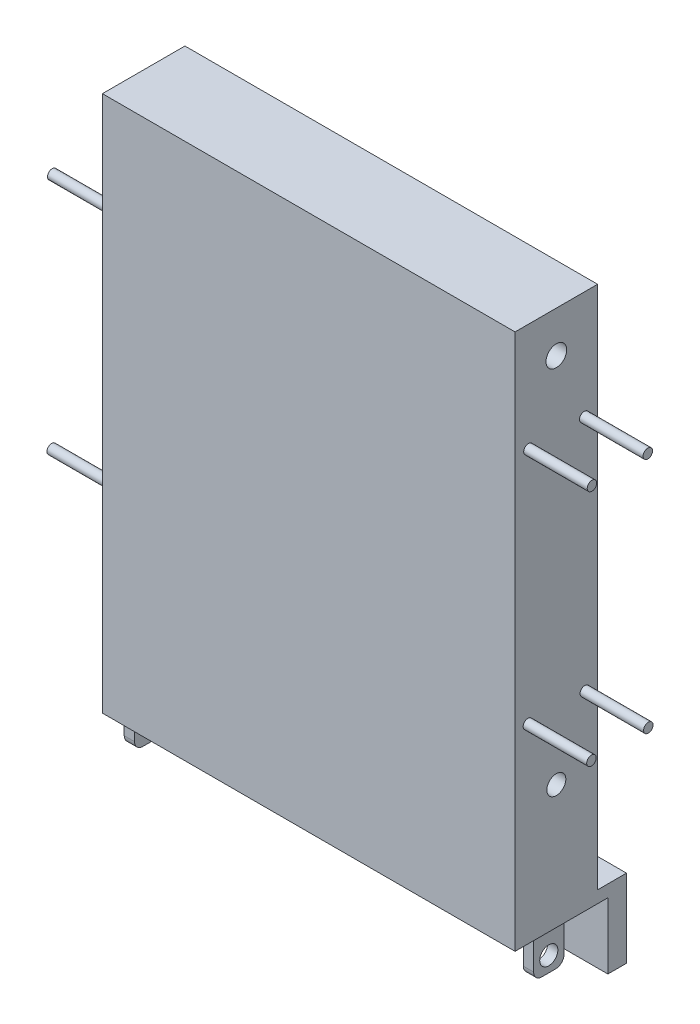
from build123d import *

# Parameters (mm, degrees)
SKETCH1_W               = 127
SKETCH1_H               = 165.1
BOSS_EXTRUDE1_DEPTH     = 25.4
SKETCH3_R               = 2.921
CUT_EXTRUDE1_DEPTH      = 10.16
SKETCH4_R               = 1.4605
BOSS_EXTRUDE2_DEPTH     = 19.558
SKETCH5_R               = 1.4605
BOSS_EXTRUDE3_DEPTH     = 19.558
SKETCH6_W               = 3.173966583
SKETCH6_H               = 9.34053023
BOSS_EXTRUDE4_DEPTH     = 11.43
SKETCH7_R               = 2.794
CUT_EXTRUDE2_DEPTH      = 176.522086644
SKETCH8_R               = 3.187487877
CUT_EXTRUDE4_DEPTH      = 10.16
SKETCH11_R              = 1.4605
BOSS_EXTRUDE5_DEPTH     = 19.558
MIRROR6_COPY_1_SKETCH_R = 1.4605
MIRROR6_COPY_1_DEPTH    = 19.558
FILLET1_R               = 2.54
SKETCH15_W              = 127
SKETCH15_H              = 3.709069246
BOSS_EXTRUDE6_DEPTH     = 8.89
SKETCH16_W              = 127
SKETCH16_H              = 5.731432552
BOSS_EXTRUDE7_DEPTH     = 20.32
SKETCH17_R              = 1.4605
BOSS_EXTRUDE8_DEPTH     = 19.558
SKETCH18_R              = 1.4605
BOSS_EXTRUDE9_DEPTH     = 19.558


with BuildPart() as part:
    # Sketch1 → Boss-Extrude1 (new body)
    with BuildSketch(Plane.XY):
        Rectangle(SKETCH1_W, SKETCH1_H)
    extrude(amount=BOSS_EXTRUDE1_DEPTH)

    # Sketch3 → Cut-Extrude1 (cut)
    with BuildSketch(Plane.ZY.offset(63.5)):
        with Locations(Location((12.7, -44.45, 0), (0, 0, 270))):
            Circle(SKETCH3_R)
    cut_extrude1 = extrude(amount=-CUT_EXTRUDE1_DEPTH, mode=Mode.SUBTRACT)

    # Mirror1: Cut-Extrude1 across plane
    add(cut_extrude1.mirror(Plane(origin=(0, 0, 0), x_dir=(0, 0, 1), z_dir=(1, 0, 0))), mode=Mode.SUBTRACT)

    # Sketch4 → Boss-Extrude2 (add)
    with BuildSketch(Plane.ZY.offset(63.5)):
        with Locations(Location((3.9497, -23.876, 0), (0, 0, 90))):
            Circle(SKETCH4_R)
    boss_extrude2 = extrude(amount=BOSS_EXTRUDE2_DEPTH)

    # Sketch5 → Boss-Extrude3 (add)
    with BuildSketch(Plane.ZY.offset(63.5)):
        with Locations(Location((21.4503, -23.876, 0), (0, 0, 90))):
            Circle(SKETCH5_R)
    boss_extrude3 = extrude(amount=BOSS_EXTRUDE3_DEPTH)

    # Mirror2: Boss-Extrude2, Boss-Extrude3 across plane
    add(boss_extrude2.mirror(Plane(origin=(0, 0, 0), x_dir=(0, 0, 1), z_dir=(1, 0, 0))))
    add(boss_extrude3.mirror(Plane(origin=(0, 0, 0), x_dir=(0, 0, 1), z_dir=(1, 0, 0))))

    # Sketch6 → Boss-Extrude4 (add)
    with BuildSketch(Plane.XZ.offset(82.55)):
        with Locations((-61.405016708, 14.51369519)):
            Rectangle(SKETCH6_W, SKETCH6_H)
    boss_extrude4 = extrude(amount=BOSS_EXTRUDE4_DEPTH)

    # Mirror3: Boss-Extrude4 across plane
    add(boss_extrude4.mirror(Plane(origin=(0, 0, 0), x_dir=(0, 0, 1), z_dir=(1, 0, 0))))

    # Sketch7 → Cut-Extrude2 (cut, through all)
    with BuildSketch(Plane.ZY.offset(62.992)):
        with Locations((14.51369519, -89.281)):
            Circle(SKETCH7_R)
    extrude(amount=-CUT_EXTRUDE2_DEPTH, mode=Mode.SUBTRACT)

    # Sketch8 → Cut-Extrude4 (cut)
    with BuildSketch(Plane(origin=(63.5, 0, 0), x_dir=(0, 0, -1), z_dir=(1, 0, 0))):
        with Locations(Location((-12.7, 69.85, 0), (0, 0, 90))):
            Circle(SKETCH8_R)
    cut_extrude4 = extrude(amount=-CUT_EXTRUDE4_DEPTH, mode=Mode.SUBTRACT)

    # Sketch11 → Boss-Extrude5 (add)
    with BuildSketch(Plane(origin=(63.5, 0, 0), x_dir=(0, 0, -1), z_dir=(1, 0, 0))):
        with Locations(Location((-21.288830822, 49.276, 0), (0, 0, 270))):
            Circle(SKETCH11_R)
    boss_extrude5 = extrude(amount=BOSS_EXTRUDE5_DEPTH)

    # Mirror4: Boss-Extrude5 across plane
    add(boss_extrude5.mirror(Plane.XY.offset(12.7)))

    # Mirror6: Cut-Extrude4, Boss-Extrude5 across plane
    add(cut_extrude4.mirror(Plane(origin=(0, 0, 0), x_dir=(0, 0, 1), z_dir=(1, 0, 0))), mode=Mode.SUBTRACT)
    add(boss_extrude5.mirror(Plane(origin=(0, 0, 0), x_dir=(0, 0, 1), z_dir=(1, 0, 0))))

    # Mirror6 copy 1 sketch → Mirror6 copy 1 (add)
    with BuildSketch(Plane(origin=(-63.5, 0, 25.4), x_dir=(0, 0, 1), z_dir=(-1, 0, 0))):
        with Locations(Location((-21.288830822, 49.276, 0), (0, 0, 270))):
            Circle(MIRROR6_COPY_1_SKETCH_R)
    extrude(amount=MIRROR6_COPY_1_DEPTH)

    # Fillet1
    fillet1_edges = [part.edges().sort_by_distance(p)[0] for p in [
        (-61.405016709, -93.98, 9.843430075),
        (-61.405016709, -93.98, 19.183960305),
        (61.405016709, -93.98, 19.183960305),
        (61.405016709, -93.98, 9.843430075),
    ]]
    fillet(fillet1_edges, radius=FILLET1_R)

    # Sketch15 → Boss-Extrude6 (add)
    with BuildSketch(Plane(origin=(0, 0, 0), x_dir=(-1, 0, 0), z_dir=(0, 0, -1))):
        with Locations((0, -80.695465377)):
            Rectangle(SKETCH15_W, SKETCH15_H)
    extrude(amount=BOSS_EXTRUDE6_DEPTH)

    # Sketch16 → Boss-Extrude7 (add)
    with BuildSketch(Plane.XZ.offset(82.55)):
        with Locations((0, -6.024283724)):
            Rectangle(SKETCH16_W, SKETCH16_H)
    extrude(amount=BOSS_EXTRUDE7_DEPTH)

    # Sketch17 → Boss-Extrude8 (add)
    with BuildSketch(Plane.ZY.offset(63.5)):
        with Locations(Location((-6.35, -80.618930754, 0), (0, 0, 90))):
            Circle(SKETCH17_R)
    extrude(amount=BOSS_EXTRUDE8_DEPTH)

    # Sketch18 → Boss-Extrude9 (add)
    with BuildSketch(Plane.ZY.offset(63.5)):
        with Locations(Location((-6.35, -98.144930754, 0), (0, 0, 90))):
            Circle(SKETCH18_R)
    extrude(amount=BOSS_EXTRUDE9_DEPTH)


solid = part.part
